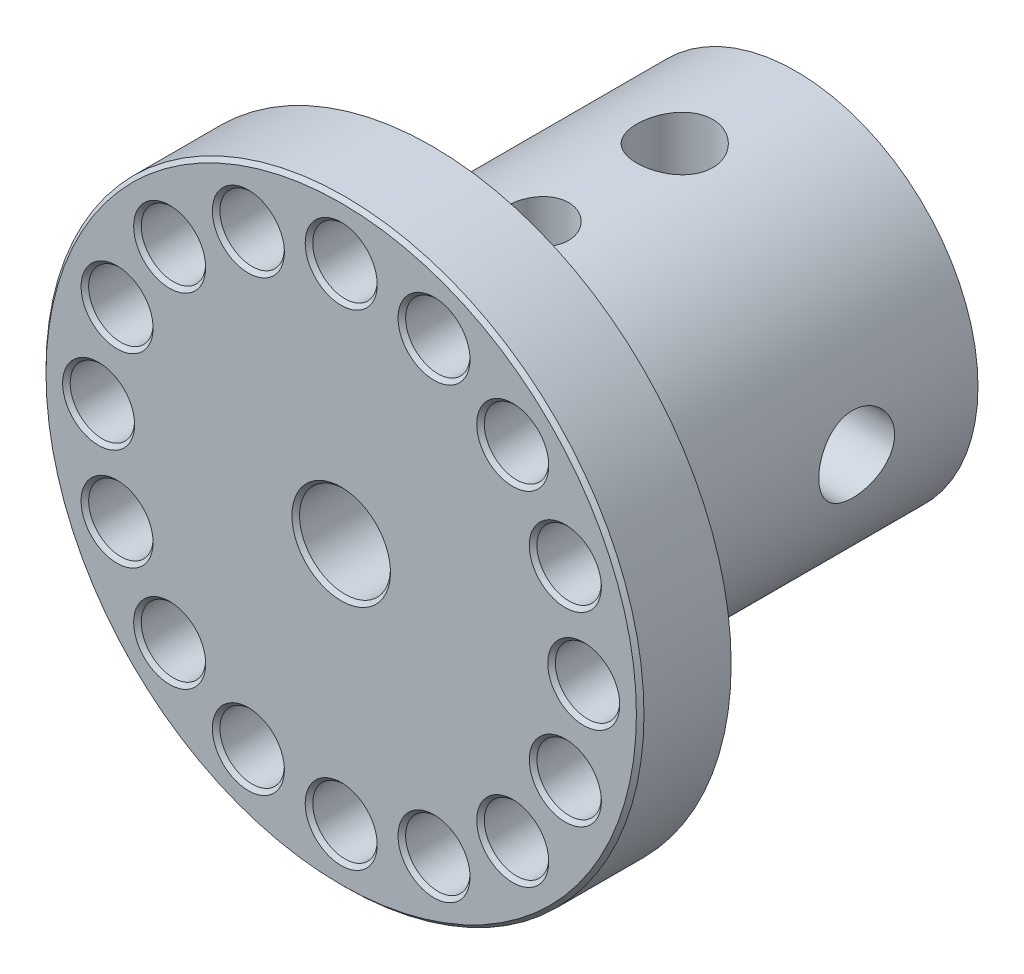
from build123d import *

# Parameters (mm, degrees)
SKETCH2_R          = 3.3734375
CUT_EXTRUDE1_DEPTH = 66.024682125
CIRPATTERN1_COUNT  = 16
SKETCH4_R          = 3.175
CUT_EXTRUDE2_DEPTH = 66.024682125
CUT_EXTRUDE3_DEPTH = 25.4
SKETCH5_R          = 3.96875
CUT_EXTRUDE4_DEPTH = 66.024682199
CIRPATTERN2_COUNT  = 2
CIRPATTERN2_ANGLE  = 90
CHAMFER1_SIZE      = 0.396875


with BuildPart() as part:
    # Sketch1 → Base-Revolve (revolve)
    with BuildSketch(Plane(origin=(0, 0, 0), x_dir=(0, 0, -1), z_dir=(1, 0, 0)), mode=Mode.PRIVATE) as base_revolve_sk:
        with BuildLine():
            Line((0, 31.3055), (0, 4.7625))
            Line((0, 4.7625), (12.3698, 4.7625))
            Line((12.3698, 4.7625), (12.3698, 7.9375))
            Line((12.3698, 7.9375), (47.625, 7.9375))
            Line((47.625, 7.9375), (47.625, 19.05))
            Line((47.625, 19.05), (12.7, 19.05))
            ThreePointArc((12.7, 19.05), (10.45493597, 19.97993597), (9.525, 22.225))
            Line((9.525, 22.225), (9.525, 31.3055))
            Line((9.525, 31.3055), (0, 31.3055))
        make_face()
    revolve(base_revolve_sk.sketch.rotate(Axis((0, 0, 8.5328125), (0, 0, -1)), 90), axis=Axis((0, 0, 8.5328125), (0, 0, -1)))

    # Sketch2 → Cut-Extrude1 (cut, through all)
    with BuildSketch(Plane.XY):
        with Locations((25.4, 0)):
            Circle(SKETCH2_R)
    cut_extrude1 = extrude(amount=-CUT_EXTRUDE1_DEPTH, mode=Mode.SUBTRACT)

    # CirPattern1: Cut-Extrude1 ×16 about axis
    cirpattern1_axis = Axis((0, 0, 0), (0, 0, 1))
    for i in range(1, CIRPATTERN1_COUNT):
        add(cut_extrude1.rotate(cirpattern1_axis, i * 360 / CIRPATTERN1_COUNT), mode=Mode.SUBTRACT)

    # Sketch4 → Cut-Extrude2 (cut, through all)
    with BuildSketch(Plane(origin=(0, 0, 0), x_dir=(1, 0, 0), z_dir=(0, 1, 0))):
        with Locations(Location((0, 20.6375, 0), (0, 0, 90))):
            Circle(SKETCH4_R)
    extrude(amount=CUT_EXTRUDE2_DEPTH, mode=Mode.SUBTRACT)

    # Sketch3 → Cut-Extrude3 (cut)
    with BuildSketch(Plane(origin=(0, 0, -47.625), x_dir=(-1, 0, 0), z_dir=(0, 0, -1))):
        with BuildLine():
            Line((-2.3876, 10.3505), (2.3876, 10.3505))
            Line((2.3876, 10.3505), (2.3876, 7.569892502))
            ThreePointArc((2.3876, 7.569892502), (0, 7.9375), (-2.3876, 7.569892502))
            Line((-2.3876, 7.569892502), (-2.3876, 10.3505))
        make_face()
    extrude(amount=-CUT_EXTRUDE3_DEPTH, mode=Mode.SUBTRACT)

    # Sketch5 → Cut-Extrude4 (cut, through all)
    with BuildSketch(Plane(origin=(0, 0, 0), x_dir=(1, 0, 0), z_dir=(0, 1, 0))):
        with Locations(Location((0, 34.925, 0), (0, 0, 90))):
            Circle(SKETCH5_R)
    cut_extrude4 = extrude(amount=CUT_EXTRUDE4_DEPTH, mode=Mode.SUBTRACT)

    # CirPattern2: Cut-Extrude4 ×2 about axis
    cirpattern2_axis = Axis((0, 0, -41.4671875), (0, 0, -1))
    for i in range(1, CIRPATTERN2_COUNT):
        add(cut_extrude4.rotate(cirpattern2_axis, i * CIRPATTERN2_ANGLE / (CIRPATTERN2_COUNT - 1)), mode=Mode.SUBTRACT)

    # Chamfer1
    chamfer1_edges = [part.edges().sort_by_distance(p)[0] for p in [
        (15.57513171, -15.57513171, 0),
        (20.349890265, -8.429200541, 0),
        (22.0265625, 0, 0),
        (20.349890265, 8.429200541, 0),
        (15.57513171, 15.57513171, 0),
        (8.429200541, 20.349890265, 0),
        (0, 22.0265625, 0),
        (-8.429200541, 20.349890265, 0),
        (-15.57513171, 15.57513171, 0),
        (-20.349890265, 8.429200541, 0),
        (-22.0265625, 0, 0),
        (-20.349890265, -8.429200541, 0),
        (-15.57513171, -15.57513171, 0),
        (-8.429200541, -20.349890265, 0),
        (-4.7625, 0, 0),
        (0, -22.0265625, 0),
        (-31.3055, 0, 0),
        (8.429200541, -20.349890265, 0),
    ]]
    chamfer(chamfer1_edges, length=CHAMFER1_SIZE)


solid = part.part
